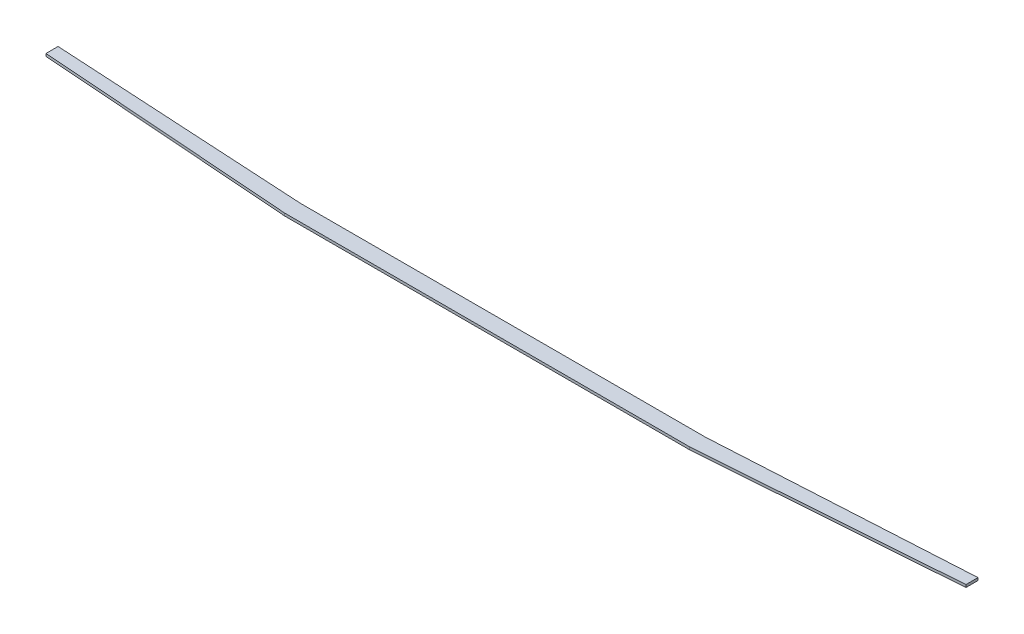
from build123d import *

# Parameters (mm, degrees)
BOSS_EXTRUDE1_DEPTH = 4.3


with BuildPart() as part:
    # Sketch1 → Boss-Extrude1 (new body)
    with BuildSketch(Plane(origin=(0, 0, 0), x_dir=(1, 0, 0), z_dir=(0, 1, 0))):
        Polygon((335.3, -13.5), (762, 17.8), (762, 37.8), (335.3, 13.5), (0, 13.5), (0, -13.5), align=None)
    boss_extrude1 = extrude(amount=BOSS_EXTRUDE1_DEPTH)

    # Mirror1: Boss-Extrude1 across plane
    add(boss_extrude1.mirror(Plane(origin=(0, 4.3, -13.5), x_dir=(0, 0, 1), z_dir=(1, 0, 0))))


solid = part.part
